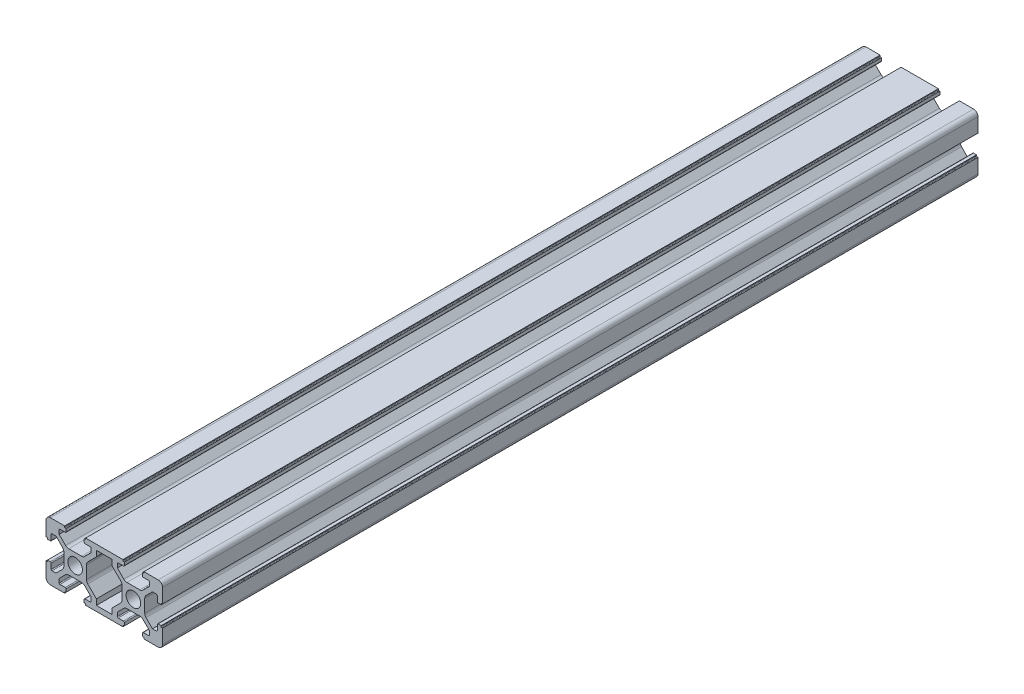
from build123d import *

# Parameters (mm, degrees)
SKETCH_1_R      = 2.5
EXTRUDE_1_DEPTH = 280


with BuildPart() as part:
    # 草图1 → 凸台-拉伸1 (new body)
    with BuildSketch(Plane.XY):
        with BuildLine():
            Line((-0.771587854, 9.545792426), (-5.671587854, 9.545792426))
            Line((-5.671587854, 9.545792426), (-5.671587854, 9.245792426))
            ThreePointArc((-5.671587854, 9.245792426), (-5.730166498, 9.10437107), (-5.871587854, 9.045792426))
            Line((-5.871587854, 9.045792426), (-6.171587854, 9.045792426))
            Line((-6.171587854, 9.045792426), (-6.171587854, 8.045792426))
            ThreePointArc((-6.171587854, 8.045792426), (-6.083719889, 7.833660392), (-5.871587854, 7.745792426))
            Line((-5.871587854, 7.745792426), (-4.071587854, 7.745792426))
            ThreePointArc((-4.071587854, 7.745792426), (-3.85945582, 7.657924461), (-3.771587854, 7.445792426))
            Line((-3.771587854, 7.445792426), (-3.771587854, 6.105792426))
            Line((-3.771587854, 6.105792426), (-5.992248026, 3.885132255))
            ThreePointArc((-5.992248026, 3.885132255), (-6.478883049, 3.559973128), (-7.052908198, 3.445792426))
            Line((-7.052908198, 3.445792426), (-11.490267511, 3.445792426))
            ThreePointArc((-11.490267511, 3.445792426), (-12.064292659, 3.559973128), (-12.550927682, 3.885132255))
            Line((-12.550927682, 3.885132255), (-14.771587854, 6.105792426))
            Line((-14.771587854, 6.105792426), (-14.771587854, 7.445792426))
            ThreePointArc((-14.771587854, 7.445792426), (-14.683719889, 7.657924461), (-14.471587854, 7.745792426))
            Line((-14.471587854, 7.745792426), (-12.671587854, 7.745792426))
            ThreePointArc((-12.671587854, 7.745792426), (-12.45945582, 7.833660392), (-12.371587854, 8.045792426))
            Line((-12.371587854, 8.045792426), (-12.371587854, 9.045792426))
            Line((-12.371587854, 9.045792426), (-12.671587854, 9.045792426))
            ThreePointArc((-12.671587854, 9.045792426), (-12.81300921, 9.10437107), (-12.871587854, 9.245792426))
            Line((-12.871587854, 9.245792426), (-12.871587854, 9.545792426))
            Line((-12.871587854, 9.545792426), (-17.771587854, 9.545792426))
            ThreePointArc((-17.771587854, 9.545792426), (-18.832248026, 9.106452598), (-19.271587854, 8.045792426))
            Line((-19.271587854, 8.045792426), (-19.271587854, 3.145792426))
            Line((-19.271587854, 3.145792426), (-18.971587854, 3.145792426))
            ThreePointArc((-18.971587854, 3.145792426), (-18.830166498, 3.087213783), (-18.771587854, 2.945792426))
            Line((-18.771587854, 2.945792426), (-18.771587854, 2.645792426))
            Line((-18.771587854, 2.645792426), (-17.771587854, 2.645792426))
            ThreePointArc((-17.771587854, 2.645792426), (-17.55945582, 2.733660392), (-17.471587854, 2.945792426))
            Line((-17.471587854, 2.945792426), (-17.471587854, 4.745792426))
            ThreePointArc((-17.471587854, 4.745792426), (-17.383719889, 4.957924461), (-17.171587854, 5.045792426))
            Line((-17.171587854, 5.045792426), (-15.831587854, 5.045792426))
            Line((-15.831587854, 5.045792426), (-13.610927682, 2.825132255))
            ThreePointArc((-13.610927682, 2.825132255), (-13.285768555, 2.338497231), (-13.171587854, 1.764472083))
            Line((-13.171587854, 1.764472083), (-13.171587854, -2.67288723))
            ThreePointArc((-13.171587854, -2.67288723), (-13.285768555, -3.246912379), (-13.610927682, -3.733547402))
            Line((-13.610927682, -3.733547402), (-15.831587854, -5.954207574))
            Line((-15.831587854, -5.954207574), (-17.171587854, -5.954207574))
            ThreePointArc((-17.171587854, -5.954207574), (-17.383719889, -5.866339608), (-17.471587854, -5.654207574))
            Line((-17.471587854, -5.654207574), (-17.471587854, -3.854207574))
            ThreePointArc((-17.471587854, -3.854207574), (-17.55945582, -3.642075539), (-17.771587854, -3.554207574))
            Line((-17.771587854, -3.554207574), (-18.771587854, -3.554207574))
            Line((-18.771587854, -3.554207574), (-18.771587854, -3.854207574))
            ThreePointArc((-18.771587854, -3.854207574), (-18.830166498, -3.99562893), (-18.971587854, -4.054207574))
            Line((-18.971587854, -4.054207574), (-19.271587854, -4.054207574))
            Line((-19.271587854, -4.054207574), (-19.271587854, -8.954207574))
            ThreePointArc((-19.271587854, -8.954207574), (-18.832248026, -10.014867745), (-17.771587854, -10.454207574))
            Line((-17.771587854, -10.454207574), (-12.871587854, -10.454207574))
            Line((-12.871587854, -10.454207574), (-12.871587854, -10.154207574))
            ThreePointArc((-12.871587854, -10.154207574), (-12.81300921, -10.012786217), (-12.671587854, -9.954207574))
            Line((-12.671587854, -9.954207574), (-12.371587854, -9.954207574))
            Line((-12.371587854, -9.954207574), (-12.371587854, -8.954207574))
            ThreePointArc((-12.371587854, -8.954207574), (-12.45945582, -8.742075539), (-12.671587854, -8.654207574))
            Line((-12.671587854, -8.654207574), (-14.471587854, -8.654207574))
            ThreePointArc((-14.471587854, -8.654207574), (-14.683719889, -8.566339608), (-14.771587854, -8.354207574))
            Line((-14.771587854, -8.354207574), (-14.771587854, -7.014207574))
            Line((-14.771587854, -7.014207574), (-12.550927682, -4.793547402))
            ThreePointArc((-12.550927682, -4.793547402), (-12.064292659, -4.468388275), (-11.490267511, -4.354207574))
            Line((-11.490267511, -4.354207574), (-7.052908198, -4.354207574))
            ThreePointArc((-7.052908198, -4.354207574), (-6.478883049, -4.468388275), (-5.992248026, -4.793547402))
            Line((-5.992248026, -4.793547402), (-3.771587854, -7.014207574))
            Line((-3.771587854, -7.014207574), (-3.771587854, -8.354207574))
            ThreePointArc((-3.771587854, -8.354207574), (-3.85945582, -8.566339608), (-4.071587854, -8.654207574))
            Line((-4.071587854, -8.654207574), (-5.871587854, -8.654207574))
            ThreePointArc((-5.871587854, -8.654207574), (-6.083719889, -8.742075539), (-6.171587854, -8.954207574))
            Line((-6.171587854, -8.954207574), (-6.171587854, -9.954207574))
            Line((-6.171587854, -9.954207574), (-5.871587854, -9.954207574))
            ThreePointArc((-5.871587854, -9.954207574), (-5.730166498, -10.012786217), (-5.671587854, -10.154207574))
            Line((-5.671587854, -10.154207574), (-5.671587854, -10.454207574))
            Line((-5.671587854, -10.454207574), (-0.771587854, -10.454207574))
            Line((-0.771587854, -10.454207574), (7.128412146, -10.454207574))
            Line((7.128412146, -10.454207574), (7.128412146, -10.154207574))
            ThreePointArc((7.128412146, -10.154207574), (7.18699079, -10.012786217), (7.328412146, -9.954207574))
            Line((7.328412146, -9.954207574), (7.628412146, -9.954207574))
            Line((7.628412146, -9.954207574), (7.628412146, -8.954207574))
            ThreePointArc((7.628412146, -8.954207574), (7.54054418, -8.742075539), (7.328412146, -8.654207574))
            Line((7.328412146, -8.654207574), (5.528412146, -8.654207574))
            ThreePointArc((5.528412146, -8.654207574), (5.316280111, -8.566339608), (5.228412146, -8.354207574))
            Line((5.228412146, -8.354207574), (5.228412146, -7.014207574))
            Line((5.228412146, -7.014207574), (7.449072318, -4.793547402))
            ThreePointArc((7.449072318, -4.793547402), (7.935707341, -4.468388275), (8.509732489, -4.354207574))
            Line((8.509732489, -4.354207574), (12.947091802, -4.354207574))
            ThreePointArc((12.947091802, -4.354207574), (13.521116951, -4.468388275), (14.007751974, -4.793547402))
            Line((14.007751974, -4.793547402), (16.228412146, -7.014207574))
            Line((16.228412146, -7.014207574), (16.228412146, -8.354207574))
            ThreePointArc((16.228412146, -8.354207574), (16.14054418, -8.566339608), (15.928412146, -8.654207574))
            Line((15.928412146, -8.654207574), (14.128412146, -8.654207574))
            ThreePointArc((14.128412146, -8.654207574), (13.916280111, -8.742075539), (13.828412146, -8.954207574))
            Line((13.828412146, -8.954207574), (13.828412146, -9.954207574))
            Line((13.828412146, -9.954207574), (14.128412146, -9.954207574))
            ThreePointArc((14.128412146, -9.954207574), (14.269833502, -10.012786217), (14.328412146, -10.154207574))
            Line((14.328412146, -10.154207574), (14.328412146, -10.454207574))
            Line((14.328412146, -10.454207574), (19.228412146, -10.454207574))
            ThreePointArc((19.228412146, -10.454207574), (20.289072318, -10.014867745), (20.728412146, -8.954207574))
            Line((20.728412146, -8.954207574), (20.728412146, -4.054207574))
            Line((20.728412146, -4.054207574), (20.428412146, -4.054207574))
            ThreePointArc((20.428412146, -4.054207574), (20.28699079, -3.99562893), (20.228412146, -3.854207574))
            Line((20.228412146, -3.854207574), (20.228412146, -3.554207574))
            Line((20.228412146, -3.554207574), (19.228412146, -3.554207574))
            ThreePointArc((19.228412146, -3.554207574), (19.016280111, -3.642075539), (18.928412146, -3.854207574))
            Line((18.928412146, -3.854207574), (18.928412146, -5.654207574))
            ThreePointArc((18.928412146, -5.654207574), (18.84054418, -5.866339608), (18.628412146, -5.954207574))
            Line((18.628412146, -5.954207574), (17.288412146, -5.954207574))
            Line((17.288412146, -5.954207574), (15.067751974, -3.733547402))
            ThreePointArc((15.067751974, -3.733547402), (14.742592847, -3.246912379), (14.628412146, -2.67288723))
            Line((14.628412146, -2.67288723), (14.628412146, 1.764472083))
            ThreePointArc((14.628412146, 1.764472083), (14.742592847, 2.338497231), (15.067751974, 2.825132255))
            Line((15.067751974, 2.825132255), (17.288412146, 5.045792426))
            Line((17.288412146, 5.045792426), (18.628412146, 5.045792426))
            ThreePointArc((18.628412146, 5.045792426), (18.84054418, 4.957924461), (18.928412146, 4.745792426))
            Line((18.928412146, 4.745792426), (18.928412146, 2.945792426))
            ThreePointArc((18.928412146, 2.945792426), (19.016280111, 2.733660392), (19.228412146, 2.645792426))
            Line((19.228412146, 2.645792426), (20.228412146, 2.645792426))
            Line((20.228412146, 2.645792426), (20.228412146, 2.945792426))
            ThreePointArc((20.228412146, 2.945792426), (20.28699079, 3.087213783), (20.428412146, 3.145792426))
            Line((20.428412146, 3.145792426), (20.728412146, 3.145792426))
            Line((20.728412146, 3.145792426), (20.728412146, 8.045792426))
            ThreePointArc((20.728412146, 8.045792426), (20.289072318, 9.106452598), (19.228412146, 9.545792426))
            Line((19.228412146, 9.545792426), (14.328412146, 9.545792426))
            Line((14.328412146, 9.545792426), (14.328412146, 9.245792426))
            ThreePointArc((14.328412146, 9.245792426), (14.269833502, 9.10437107), (14.128412146, 9.045792426))
            Line((14.128412146, 9.045792426), (13.828412146, 9.045792426))
            Line((13.828412146, 9.045792426), (13.828412146, 8.045792426))
            ThreePointArc((13.828412146, 8.045792426), (13.916280111, 7.833660392), (14.128412146, 7.745792426))
            Line((14.128412146, 7.745792426), (15.928412146, 7.745792426))
            ThreePointArc((15.928412146, 7.745792426), (16.14054418, 7.657924461), (16.228412146, 7.445792426))
            Line((16.228412146, 7.445792426), (16.228412146, 6.105792426))
            Line((16.228412146, 6.105792426), (14.007751974, 3.885132255))
            ThreePointArc((14.007751974, 3.885132255), (13.521116951, 3.559973128), (12.947091802, 3.445792426))
            Line((12.947091802, 3.445792426), (8.509732489, 3.445792426))
            ThreePointArc((8.509732489, 3.445792426), (7.935707341, 3.559973128), (7.449072318, 3.885132255))
            Line((7.449072318, 3.885132255), (5.228412146, 6.105792426))
            Line((5.228412146, 6.105792426), (5.228412146, 7.445792426))
            ThreePointArc((5.228412146, 7.445792426), (5.316280111, 7.657924461), (5.528412146, 7.745792426))
            Line((5.528412146, 7.745792426), (7.328412146, 7.745792426))
            ThreePointArc((7.328412146, 7.745792426), (7.54054418, 7.833660392), (7.628412146, 8.045792426))
            Line((7.628412146, 8.045792426), (7.628412146, 9.045792426))
            Line((7.628412146, 9.045792426), (7.328412146, 9.045792426))
            ThreePointArc((7.328412146, 9.045792426), (7.18699079, 9.10437107), (7.128412146, 9.245792426))
            Line((7.128412146, 9.245792426), (7.128412146, 9.545792426))
            Line((7.128412146, 9.545792426), (2.228412146, 9.545792426))
            Line((2.228412146, 9.545792426), (-0.771587854, 9.545792426))
        make_face()
        with Locations((10.728412146, -0.454207574)):
            Circle(SKETCH_1_R, mode=Mode.SUBTRACT)
        with Locations((-9.271587854, -0.454207574)):
            Circle(SKETCH_1_R, mode=Mode.SUBTRACT)
        with BuildLine():
            Line((-1.971587854, -6.694207574), (-4.932248026, -3.733547402))
            ThreePointArc((-4.932248026, -3.733547402), (-5.257407153, -3.246912379), (-5.371587854, -2.67288723))
            Line((-5.371587854, -2.67288723), (-5.371587854, 1.764472083))
            ThreePointArc((-5.371587854, 1.764472083), (-5.257407153, 2.338497231), (-4.932248026, 2.825132255))
            Line((-4.932248026, 2.825132255), (-1.971587854, 5.785792426))
            Line((-1.971587854, 5.785792426), (-1.971587854, 7.745792426))
            Line((-1.971587854, 7.745792426), (3.428412146, 7.745792426))
            Line((3.428412146, 7.745792426), (3.428412146, 5.785792426))
            Line((3.428412146, 5.785792426), (6.389072318, 2.825132255))
            ThreePointArc((6.389072318, 2.825132255), (6.714231445, 2.338497231), (6.828412146, 1.764472083))
            Line((6.828412146, 1.764472083), (6.828412146, -2.67288723))
            ThreePointArc((6.828412146, -2.67288723), (6.714231445, -3.246912379), (6.389072318, -3.733547402))
            Line((6.389072318, -3.733547402), (3.428412146, -6.694207574))
            Line((3.428412146, -6.694207574), (3.428412146, -8.654207574))
            Line((3.428412146, -8.654207574), (-1.971587854, -8.654207574))
            Line((-1.971587854, -8.654207574), (-1.971587854, -6.694207574))
        make_face(mode=Mode.SUBTRACT)
    extrude(amount=EXTRUDE_1_DEPTH)


solid = part.part
